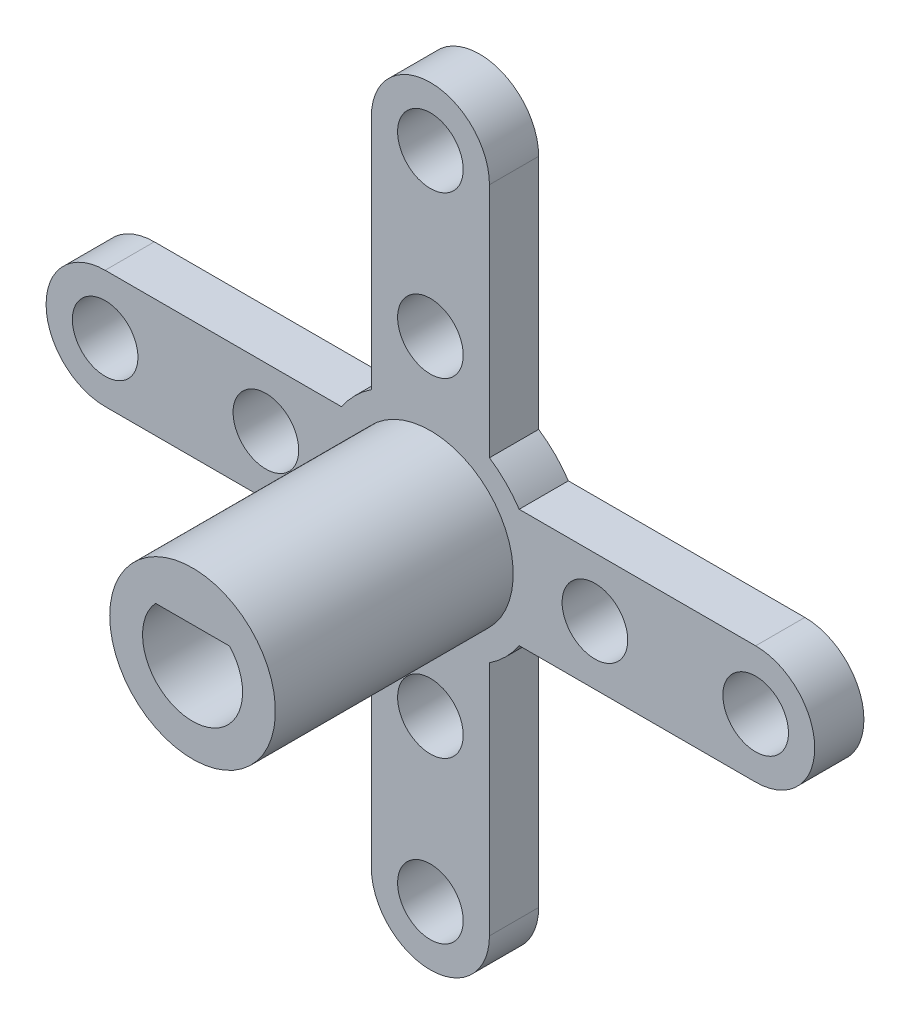
from build123d import *

# Parameters (mm, degrees)
SKETCH1_R           = 1
BOSS_EXTRUDE1_DEPTH = 1.5
CIRPATTERN1_COUNT   = 4
SKETCH3_R           = 2.525
SKETCH3_R_2         = 1.525
BOSS_EXTRUDE3_DEPTH = 7.25


with BuildPart() as part:
    # Sketch1 → Boss-Extrude1 (new body)
    with BuildSketch(Plane.XY):
        with BuildLine():
            Line((1.8, 2.706011826), (1.8, 9.915))
            ThreePointArc((1.8, 9.915), (0, 11.715), (-1.8, 9.915))
            Line((-1.8, 9.915), (-1.8, 2.706011826))
            ThreePointArc((-1.8, 2.706011826), (0, -3.25), (1.8, 2.706011826))
        make_face()
        with Locations((0, 5.015)):
            Circle(SKETCH1_R, mode=Mode.SUBTRACT)
        with Locations((0, 9.915)):
            Circle(SKETCH1_R, mode=Mode.SUBTRACT)
    boss_extrude1 = extrude(amount=BOSS_EXTRUDE1_DEPTH)

    # CirPattern1: Boss-Extrude1 ×4 about axis
    cirpattern1_axis = Axis((0, 0, 0), (0, 0, 1))
    for i in range(1, CIRPATTERN1_COUNT):
        add(boss_extrude1.rotate(cirpattern1_axis, i * 360 / CIRPATTERN1_COUNT))

    # Sketch3 → Boss-Extrude3 (add)
    # profile 1 of 3: a face of its own
    with BuildSketch(Plane.XY.offset(1.5)):
        with Locations(Location((0, 0, 0), (0, 0, 180))):
            Circle(SKETCH3_R)
        Circle(SKETCH3_R_2, mode=Mode.SUBTRACT)
    # profile 2 of 3: a face of its own
    with BuildSketch(Plane.XY.offset(1.5)):
        with BuildLine():
            ThreePointArc((1.129158979, 1.025), (0, 1.525), (-1.129158979, 1.025))
            Line((-1.129158979, 1.025), (1.129158979, 1.025))
        make_face()
    # profile 3 of 3: a face of its own
    with BuildSketch(Plane.XY.offset(1.5)):
        with BuildLine():
            ThreePointArc((1.129158979, 1.025), (0, 1.525), (-1.129158979, 1.025))
            Line((-1.129158979, 1.025), (1.129158979, 1.025))
        make_face()
    extrude(amount=BOSS_EXTRUDE3_DEPTH)


solid = part.part
